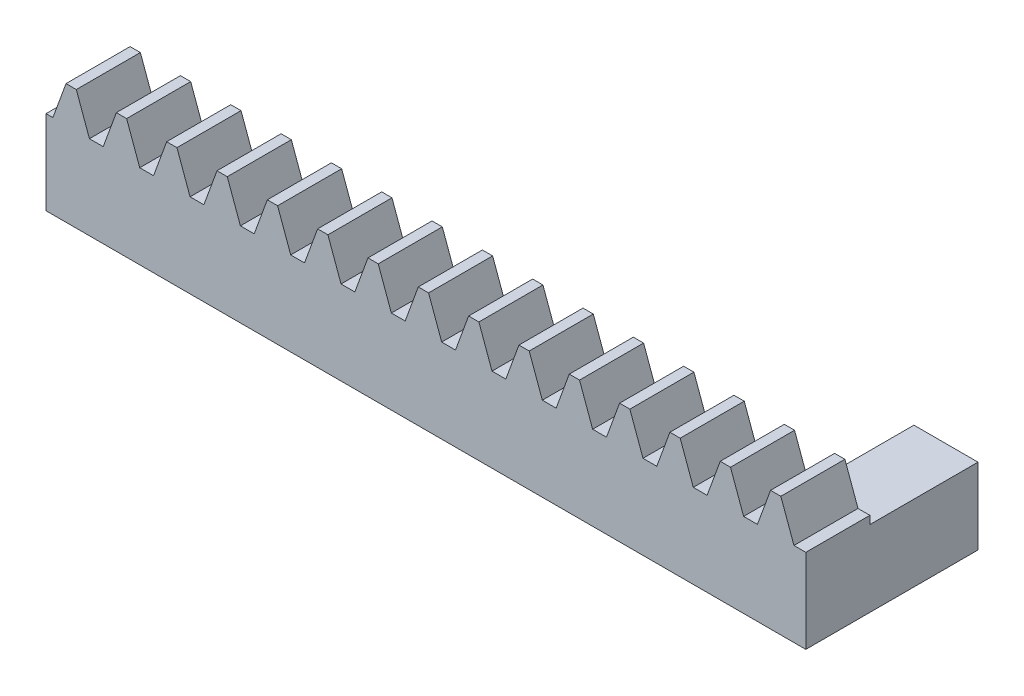
from build123d import *

# Parameters (mm, degrees)
BLANKSKE_W          = 120
BLANKSKE_H          = 16
BLANK_DEPTH         = 8
TOOTHCUTSIM_DEPTH   = 122.326007105
TEETHCUTS_COUNT     = 20
TEETHCUTS_PITCH     = 6.2831853
SKETCH1_W           = 8
SKETCH1_H           = 1
CUT_EXTRUDE1_DEPTH  = 122.326007105
SKETCH2_W           = 13.5
SKETCH2_H           = 9.5
BOSS_EXTRUDE2_DEPTH = 8
CUT_EXTRUDE2_DEPTH  = 123.956293048


with BuildPart() as part:
    # BlankSke → Blank (new body)
    with BuildSketch(Plane.XY):
        with Locations((60, 8)):
            Rectangle(BLANKSKE_W, BLANKSKE_H)
    extrude(amount=-BLANK_DEPTH)

    # TooCutSkeSim → ToothCutSim (cut, through all)
    with BuildSketch(Plane.XY):
        Polygon((0.861870739, 11.5), (-0.861870739, 11.5), (-2.508981637, 16.0254), (2.508981637, 16.0254), align=None)
    toothcutsim = extrude(amount=-TOOTHCUTSIM_DEPTH, mode=Mode.SUBTRACT)

    # TeethCuts: ToothCutSim ×20
    with Locations(*[(i * TEETHCUTS_PITCH, 0, 0) for i in range(1, TEETHCUTS_COUNT)]):
        add(toothcutsim, mode=Mode.SUBTRACT)

    # Sketch1 → Cut-Extrude1 (cut, through all)
    with BuildSketch(Plane(origin=(120, 0, 0), x_dir=(0, 0, -1), z_dir=(1, 0, 0))):
        with Locations((4, 0.5)):
            Rectangle(SKETCH1_W, SKETCH1_H)
    extrude(amount=-CUT_EXTRUDE1_DEPTH, mode=Mode.SUBTRACT)

    # Sketch2 → Boss-Extrude2 (add)
    with BuildSketch(Plane(origin=(120, 0, 0), x_dir=(0, 0, -1), z_dir=(1, 0, 0))):
        with Locations((14.75, 5.75)):
            Rectangle(SKETCH2_W, SKETCH2_H)
    extrude(amount=-BOSS_EXTRUDE2_DEPTH)

    # Sketch3 → Cut-Extrude2 (cut, through all)
    with BuildSketch(Plane.XY):
        with BuildLine():
            Line((0, 1), (0, 11.5))
            ThreePointArc((0, 11.5), (0.43093537, 11.93093537), (0.861870739, 11.5))
            Line((0.861870739, 11.5), (2.499736794, 16))
            Line((2.499736794, 16), (3.783448506, 16))
            Line((3.783448506, 16), (5.421314561, 11.5))
            Line((5.421314561, 11.5), (7.145056039, 11.5))
            Line((7.145056039, 11.5), (8.782922094, 16))
            Line((8.782922094, 16), (10.066633806, 16))
            Line((10.066633806, 16), (11.704499861, 11.5))
            Line((11.704499861, 11.5), (13.428241339, 11.5))
            Line((13.428241339, 11.5), (15.066107394, 16))
            Line((15.066107394, 16), (15.70796325, 16))
            Line((15.70796325, 16), (16.349819106, 16))
            Line((16.349819106, 16), (17.987685161, 11.5))
            Line((17.987685161, 11.5), (19.711426639, 11.5))
            Line((19.711426639, 11.5), (21.349292694, 16))
            Line((21.349292694, 16), (22.633004406, 16))
            Line((22.633004406, 16), (24.270870461, 11.5))
            Line((24.270870461, 11.5), (25.1327412, 11.5))
            Line((25.1327412, 11.5), (25.1327412, 1))
            Line((25.1327412, 1), (17.987685161, 1))
            Line((17.987685161, 1), (15.70796325, 1))
            Line((15.70796325, 1), (6.161314561, 1))
            Line((6.161314561, 1), (0, 1))
        make_face()
    extrude(amount=-CUT_EXTRUDE2_DEPTH, mode=Mode.SUBTRACT)


solid = part.part
